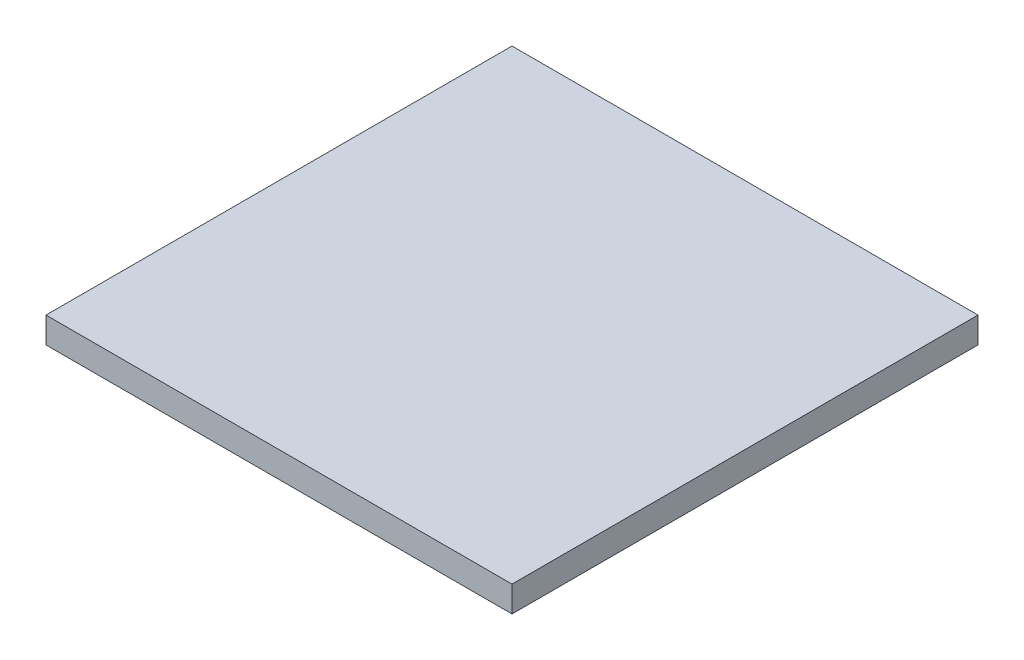
from build123d import *

# Parameters (mm, degrees)
SKETCH1_W           = 450
SKETCH1_H           = 25
BOSS_EXTRUDE1_DEPTH = 450


with BuildPart() as part:
    # Sketch1 → Boss-Extrude1 (new body)
    with BuildSketch(Plane.XY):
        with Locations((-225, 12.5)):
            Rectangle(SKETCH1_W, SKETCH1_H)
    extrude(amount=BOSS_EXTRUDE1_DEPTH)


solid = part.part
